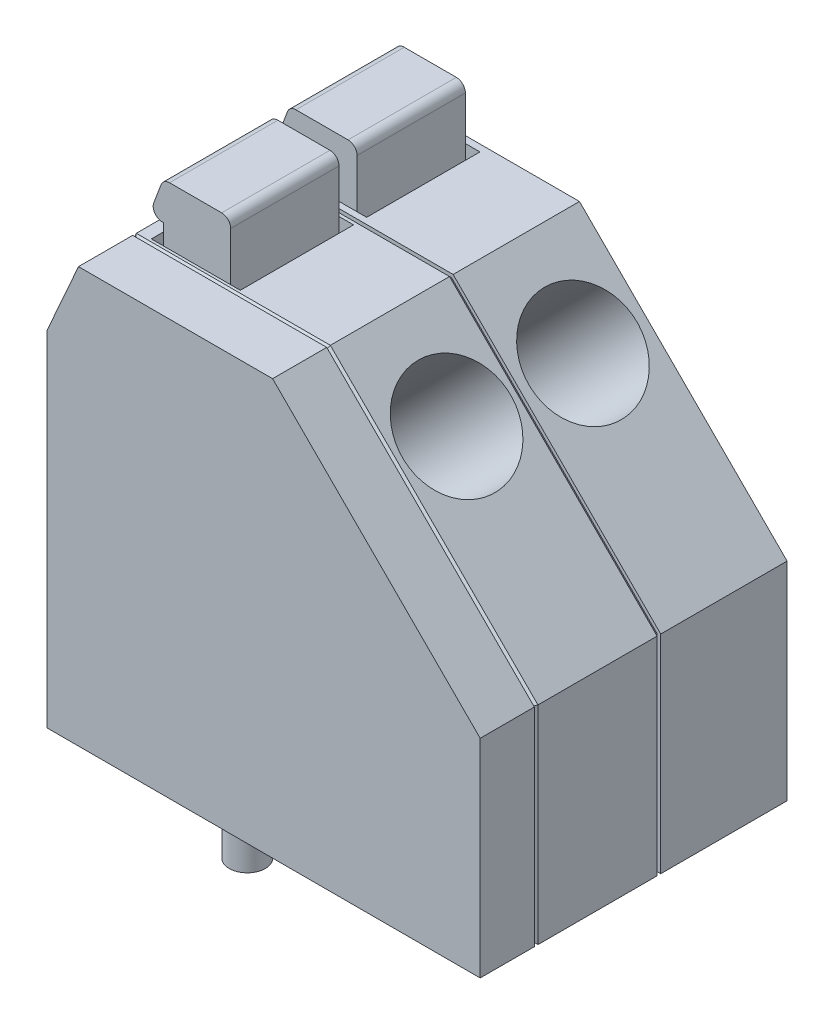
from build123d import *

# Parameters (mm, degrees)
BOSS_EXTRUDE1_DEPTH   = 3.5
SKETCH2_R             = 1.5
CUT_EXTRUDE1_DEPTH    = 5
SKETCH3_W             = 2.463564272
SKETCH3_H             = 3.137802915
CUT_EXTRUDE2_DEPTH    = 2
BOSS_EXTRUDE2_DEPTH   = 3
FILLET1_R             = 0.25
LPATTERN1_COUNT       = 2
LPATTERN1_PITCH       = 3.5
BOSS_EXTRUDE4_DEPTH   = 1.5
SKETCH8_R             = 0.5
BOSS_EXTRUDE5_DEPTH   = 3.6
BOSS_EXTRUDE5_2_DEPTH = 3.6
CHAMFER1_SIZE         = 0.1
SKETCH9_R             = 0.755713579
CUT_EXTRUDE3_DEPTH    = 0.2


with BuildPart() as part:
    # Sketch1 → Boss-Extrude1 (new body)
    with BuildSketch(Plane.XY):
        Polygon((0, 0), (12, 0), (12, 5.75), (6.25, 11.5), (0.875138122, 11.5), (0, 9.527071823), align=None)
    extrude(amount=BOSS_EXTRUDE1_DEPTH)

    # Sketch2 → Cut-Extrude1 (cut)
    with BuildSketch(Plane(origin=(8.875, 8.875, 0), x_dir=(0, 0, -1), z_dir=(0.7071067811865464, 0.7071067811865488, 0))):
        with Locations((-1.75, 1.10118655)):
            Circle(SKETCH2_R)
    extrude(amount=-CUT_EXTRUDE1_DEPTH, mode=Mode.SUBTRACT)

    # Sketch3 → Cut-Extrude2 (cut)
    with BuildSketch(Plane(origin=(0, 11.5, 0), x_dir=(1, 0, 0), z_dir=(0, 1, 0))):
        with Locations((2.451603039, -1.758644086)):
            Rectangle(SKETCH3_W, SKETCH3_H)
    extrude(amount=-CUT_EXTRUDE2_DEPTH, mode=Mode.SUBTRACT)


with BuildPart() as body_2:
    # Sketch5 → Boss-Extrude2 (new body)
    with BuildSketch(Plane(origin=(0, 0, 3.327545543), x_dir=(-1, 0, 0), z_dir=(0, 0, -1))):
        Polygon((-3.417684047, 9.5), (-3.417684047, 13.1), (-1.55035862, 13.1), (-1.160013757, 12.059784232), (-1.55035862, 12.059784232), (-1.55035862, 9.5), align=None)
    extrude(amount=BOSS_EXTRUDE2_DEPTH)

    # Fillet1
    fillet1_edges = [body_2.edges().sort_by_distance(p)[0] for p in [
        (1.160013757, 12.059784232, 1.827545543),
        (3.417684047, 13.1, 1.827545543),
        (1.55035862, 13.1, 1.827545543),
    ]]
    fillet(fillet1_edges, radius=FILLET1_R)


with BuildPart() as lpattern1_1:
    # LPattern1: pattern copy
    add(body_2.part.moved(Location(Vector(0, 0, 1) * (1 * LPATTERN1_PITCH))))


with BuildPart() as lpattern1_2:
    # LPattern1: pattern copy
    add(part.part.moved(Location(Vector(0, 0, 1) * (1 * LPATTERN1_PITCH))))

    # Chamfer1
    chamfer1_edges = [lpattern1_2.edges().sort_by_distance(p)[0] for p in [
        (6, 0, 7),
        (0, 4.763535912, 7),
        (0.437569061, 10.513535912, 7),
        (12, 2.875, 7),
        (3.562569061, 11.5, 7),
        (9.125, 8.625, 7),
        (6, 0, 3.5),
        (0, 4.763535912, 3.5),
        (0.437569061, 10.513535912, 3.5),
        (12, 2.875, 3.5),
        (3.562569061, 11.5, 3.5),
        (9.125, 8.625, 3.5),
    ]]
    chamfer(chamfer1_edges, length=CHAMFER1_SIZE)


with BuildPart() as body_5:
    # Sketch7 → Boss-Extrude4 (new body)
    with BuildSketch(Plane.XY.offset(7)):
        Polygon((0, 9.527071823), (0.875138122, 11.5), (6.25, 11.5), (12, 5.75), (12, 0), (0, 0), align=None)
    extrude(amount=BOSS_EXTRUDE4_DEPTH)


with BuildPart() as body_6:
    # Sketch8 → Boss-Extrude5 (new body)
    with BuildSketch(Plane.XZ):
        with Locations((2.3, 5.25)):
            Circle(SKETCH8_R)
    extrude(amount=BOSS_EXTRUDE5_DEPTH)


with BuildPart() as body_7:
    # Sketch8 → Boss-Extrude5 2 (new body)
    with BuildSketch(Plane.XZ):
        with Locations((7.3, 1.75)):
            Circle(SKETCH8_R)
    extrude(amount=BOSS_EXTRUDE5_2_DEPTH)


with BuildPart() as part_1:
    add(part.part)

    # Sketch9 → Cut-Extrude3 (cut)
    with BuildSketch(Plane(origin=(0, 0, 0), x_dir=(-1, 0, 0), z_dir=(0, 0, -1))):
        with Locations((-7.824779814, 2.638779832)):
            Circle(SKETCH9_R)
        with Locations((-2.362615501, 8.130785084)):
            Circle(SKETCH9_R)
    extrude(amount=-CUT_EXTRUDE3_DEPTH, mode=Mode.SUBTRACT)


solid = Compound([body_2.part, lpattern1_1.part, lpattern1_2.part, body_5.part, body_6.part, body_7.part, part_1.part])
